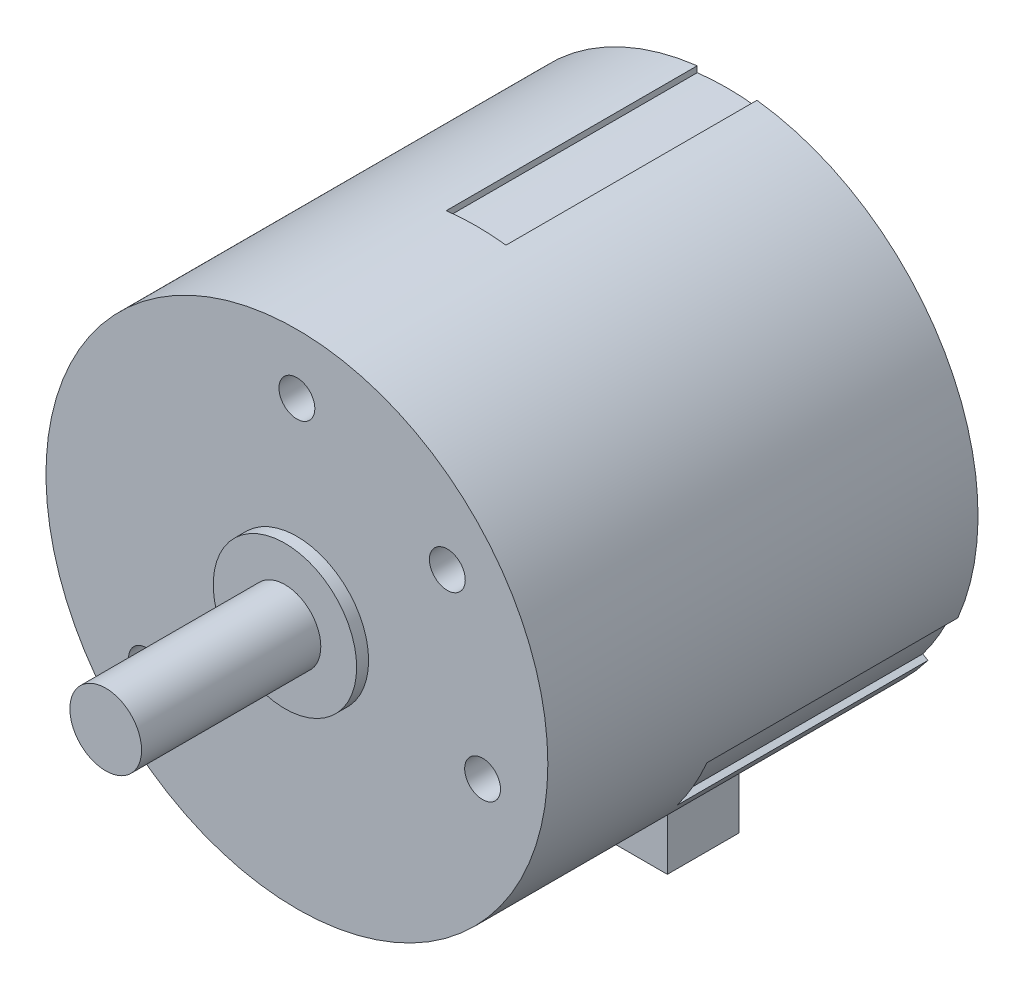
from build123d import *
from build123d.topology import SkipClean

# Parameters (mm, degrees)
SKETCH_1_R          = 21
EXTRUDE_1_DEPTH     = 15
EXTRUDE_START       = 6
EXTRUDE_2_DEPTH     = 6
EXTRUDE_3_DEPTH     = 6
EXTRUDE_START_2     = 9
EXTRUDE_4_DEPTH     = 9
SKETCH_6_R          = 6
EXTRUDE_5_DEPTH     = 1
SKETCH_7_R          = 3
EXTRUDE_6_DEPTH     = 15
SKETCH_8_R          = 1.5
CUT_EXTRUDE_1_DEPTH = 3


with BuildPart() as part:
    # 草图1 → 凸台-拉伸1 (new body)
    with BuildSketch(Plane.XY):
        Circle(SKETCH_1_R)
    extrude(amount=EXTRUDE_1_DEPTH)

    # 草图2 → 凸台-拉伸2 (add)
    with SkipClean():  # the faces are left unmerged after this step: merging them gives an invalid solid
        with BuildSketch(Plane(origin=(0, 0, 0), x_dir=(-1, 0, 0), z_dir=(0, 0, -1)).offset(EXTRUDE_START)):
            with BuildLine():
                Line((2.5, 20.850659462), (2.5, 20.346989949))
                ThreePointArc((2.5, 20.346989949), (0, 20.5), (-2.5, 20.346989949))
                Line((-2.5, 20.346989949), (-2.5, 20.850659462))
                ThreePointArc((-2.5, 20.850659462), (-18.186533479, 10.5), (-19.30720078, -8.260266222))
                Line((-19.30720078, -8.260266222), (-18.871010187, -8.008431465))
                ThreePointArc((-18.871010187, -8.008431465), (-17.753520778, -10.25), (-16.371010187, -12.338558484))
                Line((-16.371010187, -12.338558484), (-16.80720078, -12.59039324))
                ThreePointArc((-16.80720078, -12.59039324), (-15.938440593, -13.673555187), (-15, -14.696938457))
                Line((-15, -14.696938457), (-15, -13.973188612))
                ThreePointArc((-15, -13.973188612), (0, -20.5), (15, -13.973188612))
                Line((15, -13.973188612), (15, -14.696938457))
                ThreePointArc((15, -14.696938457), (15.938440593, -13.673555187), (16.80720078, -12.59039324))
                Line((16.80720078, -12.59039324), (16.371010187, -12.338558484))
                ThreePointArc((16.371010187, -12.338558484), (17.753520778, -10.25), (18.871010187, -8.008431465))
                Line((18.871010187, -8.008431465), (19.30720078, -8.260266222))
                ThreePointArc((19.30720078, -8.260266222), (18.186533479, 10.5), (2.5, 20.850659462))
            make_face()
        extrude(amount=-EXTRUDE_2_DEPTH)

    # 草图4 → 凸台-拉伸3 (add)
    with SkipClean():  # the faces are left unmerged after this step: merging them gives an invalid solid
        with BuildSketch(Plane(origin=(0, 0, -6), x_dir=(-1, 0, 0), z_dir=(0, 0, -1)).offset(EXTRUDE_START)):
            with BuildLine():
                Line((10, -17.895530168), (10, -24))
                Line((10, -24), (-10, -24))
                Line((-10, -24), (-10, -17.895530168))
                ThreePointArc((-10, -17.895530168), (-12.652912345, -16.129284212), (-15, -13.973188612))
                Line((-15, -13.973188612), (-15, -14.696938457))
                ThreePointArc((-15, -14.696938457), (-15.938440593, -13.673555187), (-16.80720078, -12.59039324))
                Line((-16.80720078, -12.59039324), (-16.371010187, -12.338558484))
                ThreePointArc((-16.371010187, -12.338558484), (-17.753520778, -10.25), (-18.871010187, -8.008431465))
                Line((-18.871010187, -8.008431465), (-19.30720078, -8.260266222))
                ThreePointArc((-19.30720078, -8.260266222), (-18.186533479, 10.5), (-2.5, 20.850659462))
                Line((-2.5, 20.850659462), (-2.5, 20.346989949))
                ThreePointArc((-2.5, 20.346989949), (0, 20.5), (2.5, 20.346989949))
                Line((2.5, 20.346989949), (2.5, 20.850659462))
                ThreePointArc((2.5, 20.850659462), (18.186533479, 10.5), (19.30720078, -8.260266222))
                Line((19.30720078, -8.260266222), (18.871010187, -8.008431465))
                ThreePointArc((18.871010187, -8.008431465), (17.753520778, -10.25), (16.371010187, -12.338558484))
                Line((16.371010187, -12.338558484), (16.80720078, -12.59039324))
                ThreePointArc((16.80720078, -12.59039324), (15.938440593, -13.673555187), (15, -14.696938457))
                Line((15, -14.696938457), (15, -13.973188612))
                ThreePointArc((15, -13.973188612), (12.652912345, -16.129284212), (10, -17.895530168))
            make_face()
        extrude(amount=-EXTRUDE_3_DEPTH)

    # 草图5 → 凸台-拉伸4 (add)
    with SkipClean():  # the faces are left unmerged after this step: merging them gives an invalid solid
        with BuildSketch(Plane(origin=(0, 0, -12), x_dir=(-1, 0, 0), z_dir=(0, 0, -1)).offset(EXTRUDE_START_2)):
            with BuildLine():
                Line((18.871010187, -8.008431465), (19.30720078, -8.260266222))
                ThreePointArc((19.30720078, -8.260266222), (18.186533479, 10.5), (2.5, 20.850659462))
                Line((2.5, 20.850659462), (2.5, 20.346989949))
                ThreePointArc((2.5, 20.346989949), (0, 20.5), (-2.5, 20.346989949))
                Line((-2.5, 20.346989949), (-2.5, 20.850659462))
                ThreePointArc((-2.5, 20.850659462), (-18.186533479, 10.5), (-19.30720078, -8.260266222))
                Line((-19.30720078, -8.260266222), (-18.871010187, -8.008431465))
                ThreePointArc((-18.871010187, -8.008431465), (-17.753520778, -10.25), (-16.371010187, -12.338558484))
                Line((-16.371010187, -12.338558484), (-16.80720078, -12.59039324))
                ThreePointArc((-16.80720078, -12.59039324), (-15.938440593, -13.673555187), (-15, -14.696938457))
                ThreePointArc((-15, -14.696938457), (0, -21), (15, -14.696938457))
                ThreePointArc((15, -14.696938457), (15.938440593, -13.673555187), (16.80720078, -12.59039324))
                Line((16.80720078, -12.59039324), (16.371010187, -12.338558484))
                ThreePointArc((16.371010187, -12.338558484), (17.753520778, -10.25), (18.871010187, -8.008431465))
            make_face()
        extrude(amount=-EXTRUDE_4_DEPTH)

    # 草图6 → 凸台-拉伸5 (add)
    with SkipClean():  # the faces are left unmerged after this step: merging them gives an invalid solid
        with BuildSketch(Plane.XY.offset(15)):
            Circle(SKETCH_6_R)
        extrude(amount=EXTRUDE_5_DEPTH)

    # 草图7 → 凸台-拉伸6 (add)
    with SkipClean():  # the faces are left unmerged after this step: merging them gives an invalid solid
        with BuildSketch(Plane.XY.offset(16)):
            Circle(SKETCH_7_R)
        extrude(amount=EXTRUDE_6_DEPTH)

    # 草图8 → 切除-拉伸1 (cut)
    with SkipClean():  # the faces are left unmerged after this step: merging them gives an invalid solid
        with BuildSketch(Plane.XY.offset(15)):
            with Locations((0, 16)):
                Circle(SKETCH_8_R)
            with Locations((12.589057749, 9.875)):
                Circle(SKETCH_8_R)
            with Locations((15.539618159, -3.810546875)):
                Circle(SKETCH_8_R)
            with Locations((-12.589057749, -9.875)):
                Circle(SKETCH_8_R)
        extrude(amount=-CUT_EXTRUDE_1_DEPTH, mode=Mode.SUBTRACT)


solid = part.part
